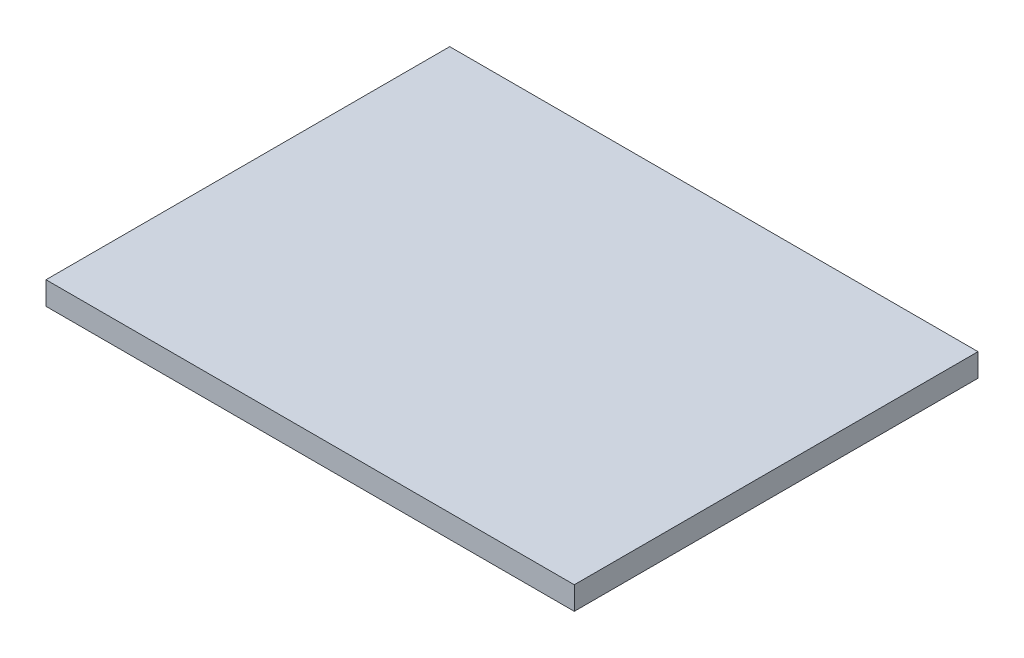
from build123d import *

# Parameters (mm, degrees)
SKETCH1_W           = 229
SKETCH1_H           = 175
BOSS_EXTRUDE1_DEPTH = 10


with BuildPart() as part:
    # Sketch1 → Boss-Extrude1 (new body)
    with BuildSketch(Plane(origin=(0, 0, 0), x_dir=(1, 0, 0), z_dir=(0, 1, 0))):
        with Locations((114.5, 87.5)):
            Rectangle(SKETCH1_W, SKETCH1_H)
    extrude(amount=BOSS_EXTRUDE1_DEPTH)


solid = part.part
